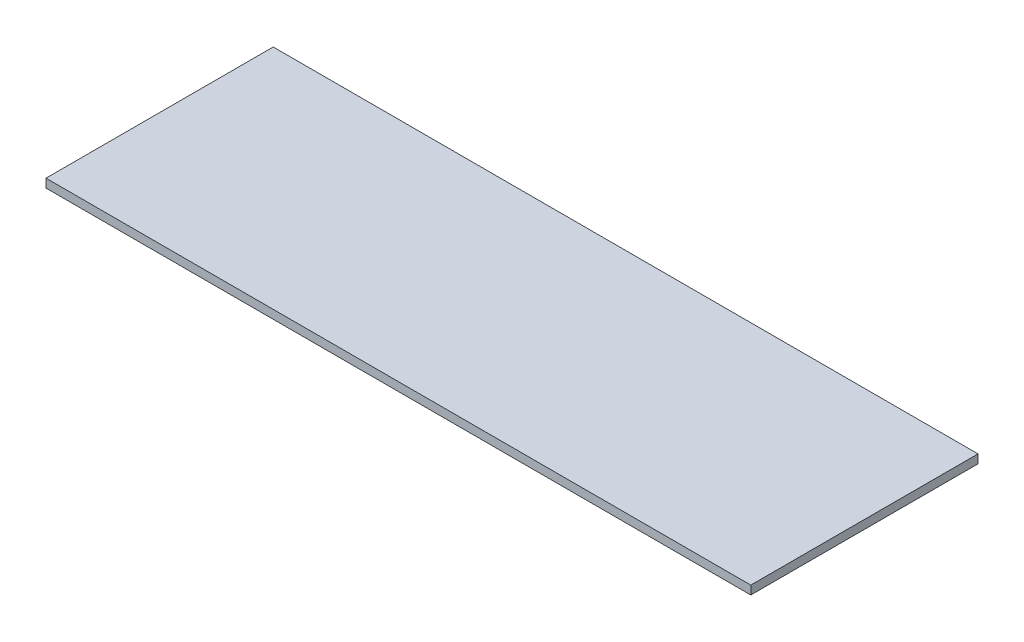
from build123d import *

# Parameters (mm, degrees)
SKETCH1_W           = 335
SKETCH1_H           = 108
BOSS_EXTRUDE2_DEPTH = 4.095165483


with BuildPart() as part:
    # Sketch1 → Boss-Extrude2 (new body)
    with BuildSketch(Plane(origin=(0, 0, 0), x_dir=(1, 0, 0), z_dir=(0, 1, 0))):
        Rectangle(SKETCH1_W, SKETCH1_H)
    extrude(amount=BOSS_EXTRUDE2_DEPTH)


solid = part.part
